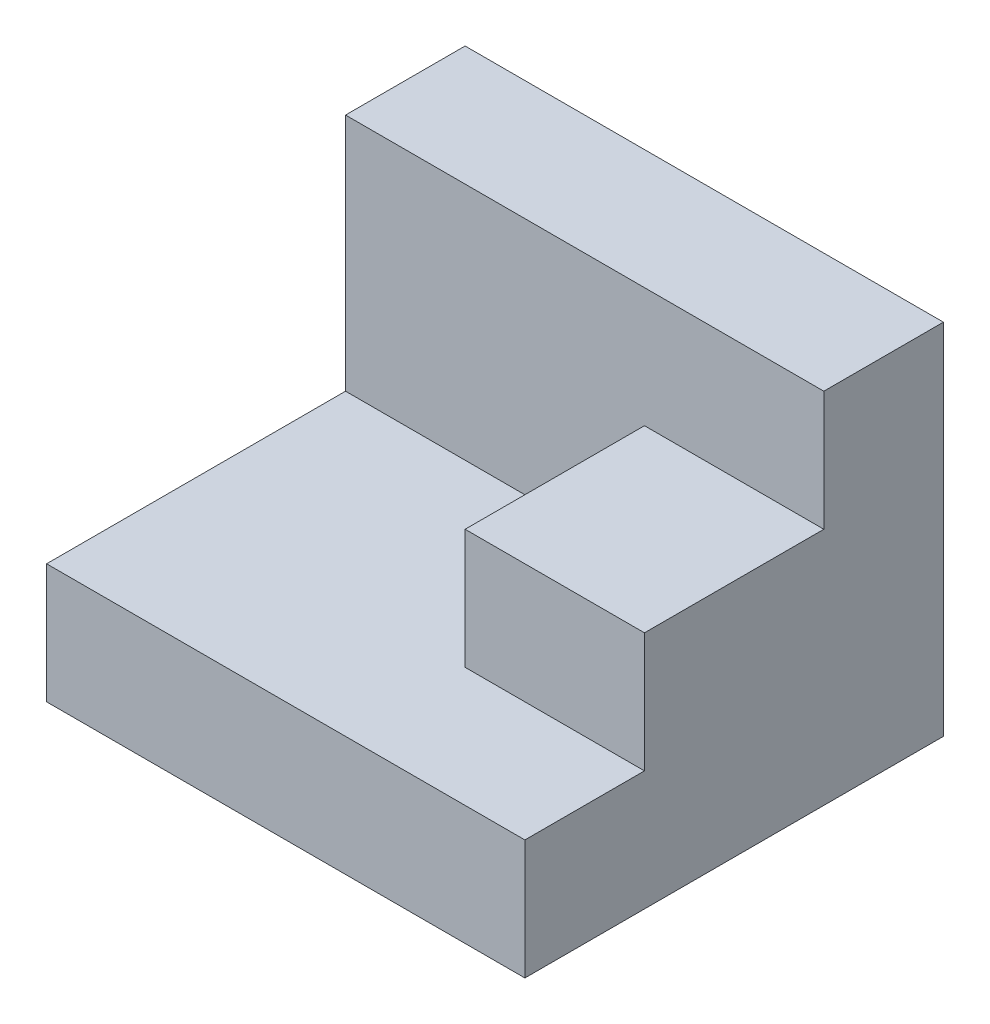
from build123d import *

# Parameters (mm, degrees)
SKETCH1_W           = 40
SKETCH1_H           = 30
BOSS_EXTRUDE1_DEPTH = 10
SKETCH1_3_W         = 15
SKETCH1_3_H         = 10
BOSS_EXTRUDE2_DEPTH = 25
BOSS_EXTRUDE4_DEPTH = 35


with BuildPart() as part:
    # Sketch1 → Boss-Extrude1 (new body)
    with BuildSketch(Plane.XY):
        with Locations((20, 15)):
            Rectangle(SKETCH1_W, SKETCH1_H)
    extrude(amount=BOSS_EXTRUDE1_DEPTH)

    # Sketch1<3> → Boss-Extrude2 (add)
    with BuildSketch(Plane.XY):
        with Locations((32.5, 15)):
            Rectangle(SKETCH1_3_W, SKETCH1_3_H)
    extrude(amount=BOSS_EXTRUDE2_DEPTH)

    # Sketch1<5> → Boss-Extrude4 (add)
    with BuildSketch(Plane.XY):
        Polygon((0, 10), (0, 0), (40, 0), (40, 10), (25, 10), align=None)
    extrude(amount=BOSS_EXTRUDE4_DEPTH)


solid = part.part
